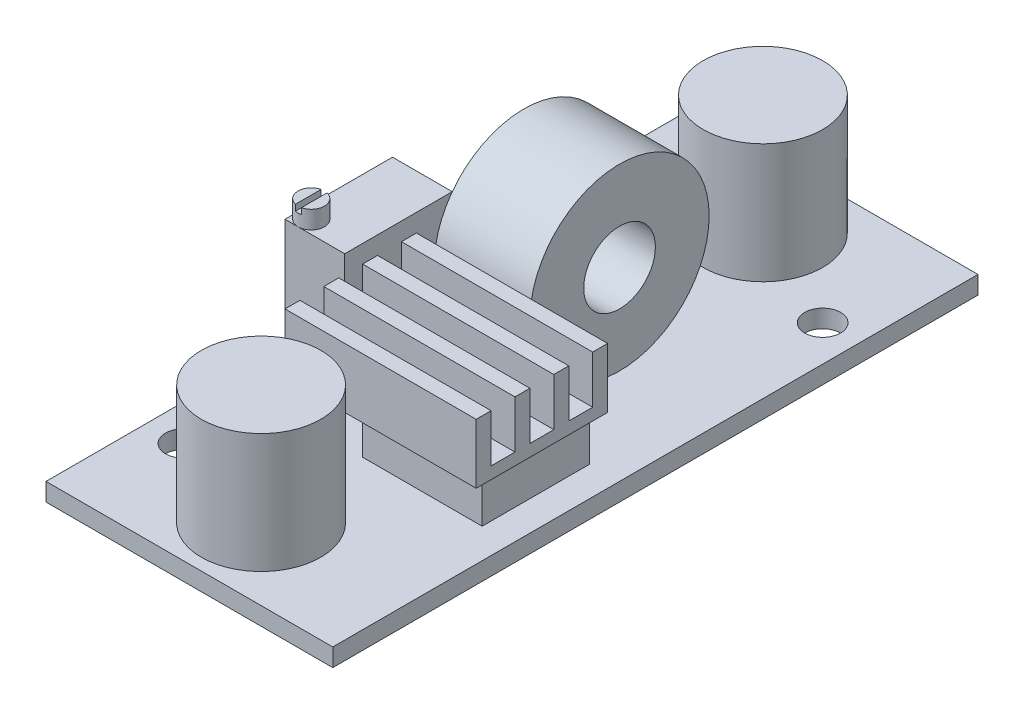
from build123d import *

# Parameters (mm, degrees)
SKETCH1_W           = 24
SKETCH1_H           = 54
BOSS_EXTRUDE1_DEPTH = 1.5
SKETCH2_R           = 1.5
CUT_EXTRUDE1_DEPTH  = 30.584624385
SKETCH3_R           = 5
BOSS_EXTRUDE2_DEPTH = 10
SKETCH4_W           = 5
SKETCH4_H           = 9
BOSS_EXTRUDE3_DEPTH = 10
SKETCH5_R           = 1.1
BOSS_EXTRUDE4_DEPTH = 1.5
SKETCH6_W           = 0.5
SKETCH6_H           = 2.2
CUT_EXTRUDE2_DEPTH  = 0.5
SKETCH7_R           = 7.5
SKETCH7_R_2         = 3
BOSS_EXTRUDE5_DEPTH = 4
SKETCH8_W           = 10
SKETCH8_H           = 9
BOSS_EXTRUDE6_DEPTH = 4.5
SKETCH9_W           = 16
SKETCH9_H           = 11
BOSS_EXTRUDE7_DEPTH = 5
SKETCH10_W          = 2
SKETCH10_H          = 4
CUT_EXTRUDE3_DEPTH  = 16


with BuildPart() as part:
    # Sketch1 → Boss-Extrude1 (new body)
    with BuildSketch(Plane(origin=(0, 0, 0), x_dir=(1, 0, 0), z_dir=(0, 1, 0))):
        Rectangle(SKETCH1_W, SKETCH1_H)
    extrude(amount=BOSS_EXTRUDE1_DEPTH)

    # Sketch2 → Cut-Extrude1 (cut, through all)
    with BuildSketch(Plane(origin=(0, 1.5, 0), x_dir=(1, 0, 0), z_dir=(0, 1, 0))):
        with Locations(Location((9, 17, 0), (0, 0, 270))):
            Circle(SKETCH2_R)
        with Locations(Location((-9, -18.5, 0), (0, 0, 270))):
            Circle(SKETCH2_R)
    extrude(amount=-CUT_EXTRUDE1_DEPTH, mode=Mode.SUBTRACT)

    # Sketch3 → Boss-Extrude2 (add)
    with BuildSketch(Plane(origin=(0, 1.5, 0), x_dir=(1, 0, 0), z_dir=(0, 1, 0))):
        with Locations(Location((0, -21, 0), (0, 0, 270))):
            Circle(SKETCH3_R)
        with Locations(Location((0, 21, 0), (0, 0, 90))):
            Circle(SKETCH3_R)
    extrude(amount=BOSS_EXTRUDE2_DEPTH)

    # Sketch4 → Boss-Extrude3 (add)
    with BuildSketch(Plane(origin=(0, 1.5, 0), x_dir=(1, 0, 0), z_dir=(0, 1, 0))):
        with Locations((-8.5, -3.5)):
            Rectangle(SKETCH4_W, SKETCH4_H)
    extrude(amount=BOSS_EXTRUDE3_DEPTH)

    # Sketch8 → Boss-Extrude6 (add)
    with BuildSketch(Plane(origin=(0, 1.5, 0), x_dir=(1, 0, 0), z_dir=(0, 1, 0))):
        with Locations((4.5, -7.5)):
            Rectangle(SKETCH8_W, SKETCH8_H)
    extrude(amount=BOSS_EXTRUDE6_DEPTH)


with BuildPart() as body_2:
    # Sketch5 → Boss-Extrude4 (new body)
    with BuildSketch(Plane(origin=(0, 11.5, 0), x_dir=(-1, 0, 0), z_dir=(0, 1, 0))):
        with Locations(Location((9.9, 6.9, 0), (0, 0, 90))):
            Circle(SKETCH5_R)
    extrude(amount=BOSS_EXTRUDE4_DEPTH)

    # Sketch6 → Cut-Extrude2 (cut)
    with BuildSketch(Plane(origin=(0, 13, 0), x_dir=(-1, 0, 0), z_dir=(0, 1, 0))):
        with Locations((9.9, 6.9)):
            Rectangle(SKETCH6_W, SKETCH6_H)
    extrude(amount=-CUT_EXTRUDE2_DEPTH, mode=Mode.SUBTRACT)


with BuildPart() as body_3:
    # Sketch7 → Boss-Extrude5 (new, symmetric)
    with BuildSketch(Plane(origin=(0, 0, 0), x_dir=(0, 0, -1), z_dir=(1, 0, 0))):
        with Locations((5, 9)):
            Circle(SKETCH7_R)
        with Locations((5, 9)):
            Circle(SKETCH7_R_2, mode=Mode.SUBTRACT)
    extrude(amount=BOSS_EXTRUDE5_DEPTH, both=True)


with BuildPart() as body_4:
    # Sketch9 → Boss-Extrude7 (new body)
    with BuildSketch(Plane(origin=(0, 6, 0), x_dir=(1, 0, 0), z_dir=(0, 1, 0))):
        with Locations((3, -8.5)):
            Rectangle(SKETCH9_W, SKETCH9_H)
    extrude(amount=BOSS_EXTRUDE7_DEPTH)

    # Sketch10 → Cut-Extrude3 (cut)
    with BuildSketch(Plane(origin=(11, 0, 0), x_dir=(0, 0, -1), z_dir=(1, 0, 0))):
        with Locations((-11.75, 9)):
            Rectangle(SKETCH10_W, SKETCH10_H)
        with Locations((-8.5, 9)):
            Rectangle(SKETCH10_W, SKETCH10_H)
        with Locations((-5.25, 9)):
            Rectangle(SKETCH10_W, SKETCH10_H)
    extrude(amount=-CUT_EXTRUDE3_DEPTH, mode=Mode.SUBTRACT)


solid = Compound([part.part, body_2.part, body_3.part, body_4.part])
